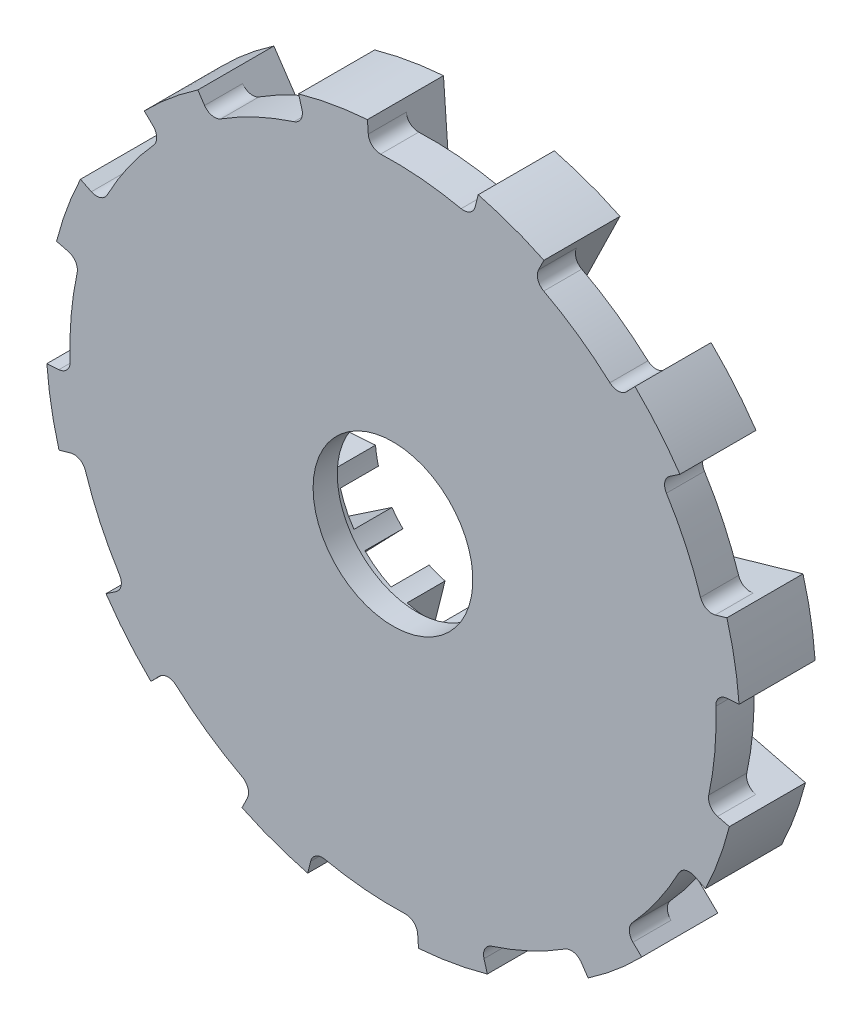
from build123d import *

# Parameters (mm, degrees)
CUT_EXTRUDE1_DEPTH = 125.362866242
CUT_EXTRUDE2_START = 9.525
CUT_EXTRUDE2_DEPTH = 9.525
CIRPATTERN2_COUNT  = 12


with BuildPart() as part:
    # Sketch4 → Revolve1 (revolve)
    with BuildSketch(Plane.YZ):
        Polygon((-20, 13), (-20, 19.05), (-86.9, 19.05), (-86.9, 0), (-23.5, 0), (-23.5, 13), align=None)
    revolve(axis=Axis((0, 0, 0), (0, 0, 1)))

    # Sketch1<4> → Cut-Extrude1 (cut, symmetric)
    with BuildSketch(Plane(origin=(0, 0, 0), x_dir=(0, 1, 0), z_dir=(0, 0, 1))):
        with BuildLine():
            Line((-48.868586739, 71.857297682), (-47.16763138, 69.335527658))
            ThreePointArc((-47.16763138, 69.335527658), (-45.299705883, 68.077700471), (-43.08288383, 68.47390102))
            ThreePointArc((-43.08288383, 68.47390102), (-34.189817375, 73.320299971), (-24.76090746, 77.017578914))
            ThreePointArc((-24.76090746, 77.017578914), (-23.032454577, 78.461090147), (-22.795326532, 80.700519613))
            Line((-22.795326532, 80.700519613), (-23.633761528, 83.62448993))
            ThreePointArc((-23.633761528, 83.62448993), (-36.725526945, 78.758146693), (-48.868586739, 71.857297682))
        make_face()
    cut_extrude1 = extrude(amount=CUT_EXTRUDE1_DEPTH, both=True, mode=Mode.SUBTRACT)

    # Sketch1 → Cut-Extrude2 (cut)
    with BuildSketch(Plane(origin=(0, 0, 0), x_dir=(0, 1, 0), z_dir=(0, 0, 1)).offset(CUT_EXTRUDE2_START)):
        with BuildLine():
            ThreePointArc((-43.08288383, 68.47390102), (-45.299705883, 68.077700471), (-47.16763138, 69.335527658))
            Line((-47.16763138, 69.335527658), (-10.3132812, 14.696706561))
            ThreePointArc((-10.3132812, 14.696706561), (-6.339273926, 13.594616806), (-4.629081023, 17.347292634))
            Line((-4.629081023, 17.347292634), (-22.795326532, 80.700519613))
            ThreePointArc((-22.795326532, 80.700519613), (-23.032454577, 78.461090147), (-24.76090746, 77.017578914))
            ThreePointArc((-24.76090746, 77.017578914), (-34.189817375, 73.320299971), (-43.08288383, 68.47390102))
        make_face()
    cut_extrude2 = extrude(amount=-CUT_EXTRUDE2_DEPTH, mode=Mode.SUBTRACT)

    # CirPattern2: Cut-Extrude1, Cut-Extrude2 ×12 about axis
    cirpattern2_axis = Axis((0, 0, 20.00502805), (0, 0, -1))
    add([cut_extrude1.rotate(cirpattern2_axis, i * 360 / CIRPATTERN2_COUNT) for i in range(1, CIRPATTERN2_COUNT)], mode=Mode.SUBTRACT)
    add([cut_extrude2.rotate(cirpattern2_axis, i * 360 / CIRPATTERN2_COUNT) for i in range(1, CIRPATTERN2_COUNT)], mode=Mode.SUBTRACT)


solid = part.part
